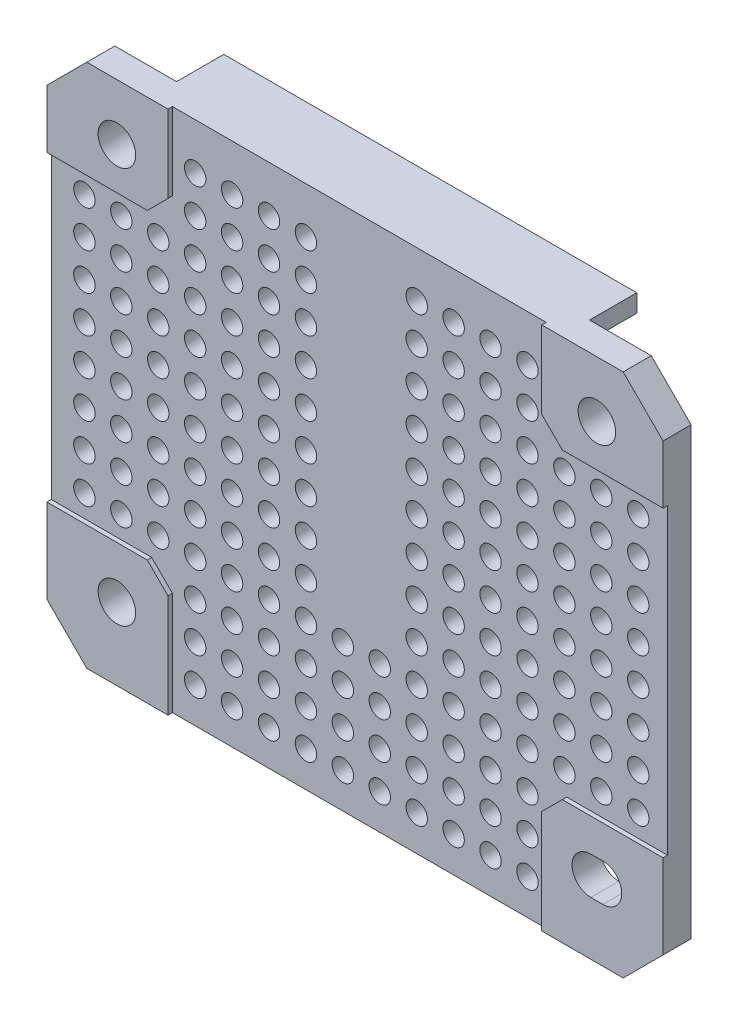
from build123d import *

# Parameters (mm, degrees)
BOSS_EXTRUDE1_DEPTH = 2.032
BOSS_EXTRUDE2_DEPTH = 0.381
SKETCH3_W           = 35.5092
SKETCH3_H           = 1.524
BOSS_EXTRUDE3_DEPTH = 4.064
SKETCH4_R           = 1.6129
SKETCH4_R_2         = 0.92075
CUT_EXTRUDE1_DEPTH  = 70.721612008


with BuildPart() as part:
    # Sketch1 → Boss-Extrude1 (new body)
    with BuildSketch(Plane.XY):
        Polygon((0, 41.7068), (3.429, 45.1358), (49.5554, 45.1358), (52.9844, 41.7068), (52.9844, 3.429), (49.5554, 0), (3.429, 0), (0, 3.429), align=None)
    extrude(amount=BOSS_EXTRUDE1_DEPTH)

    # Sketch2 → Boss-Extrude2 (add)
    with BuildSketch(Plane.XY.offset(2.032)):
        Polygon((3.429, 45.1358), (0, 41.7068), (0, 36.703), (8.636, 36.703), (10.414, 38.481), (10.414, 45.1358), align=None)
        Polygon((42.545, 45.1358), (42.545, 38.481), (44.323, 36.703), (52.9844, 36.703), (52.9844, 41.7068), (49.5554, 45.1358), align=None)
        Polygon((0, 10.668), (8.636, 10.668), (10.414, 8.89), (10.414, 0), (3.429, 0), (0, 3.429), align=None)
        Polygon((52.9844, 10.668), (44.323, 10.668), (42.545, 8.89), (42.545, 0), (49.5554, 0), (52.9844, 3.429), align=None)
    extrude(amount=BOSS_EXTRUDE2_DEPTH)

    # Sketch3 → Boss-Extrude3 (add)
    with BuildSketch(Plane(origin=(0, 0, 0), x_dir=(-1, 0, 0), z_dir=(0, 0, -1))):
        with Locations((-26.4922, 44.3738)):
            Rectangle(SKETCH3_W, SKETCH3_H)
    extrude(amount=BOSS_EXTRUDE3_DEPTH)

    # Sketch4 → Cut-Extrude1 (cut, through all)
    with BuildSketch(Plane(origin=(0, 0, 0), x_dir=(-1, 0, 0), z_dir=(0, 0, -1))):
        with Locations((-47.2948, 40.3098)):
            Circle(SKETCH4_R)
        with Locations((-6.0198, 40.3098)):
            Circle(SKETCH4_R)
        with Locations((-6.0198, 6.223)):
            Circle(SKETCH4_R)
        with Locations((-2.8448, 12.573)):
            Circle(SKETCH4_R_2)
        with Locations((-6.0198, 12.573)):
            Circle(SKETCH4_R_2)
        with Locations((-9.1948, 12.573)):
            Circle(SKETCH4_R_2)
        with Locations((-40.9448, 12.573)):
            Circle(SKETCH4_R_2)
        with Locations((-44.1198, 12.573)):
            Circle(SKETCH4_R_2)
        with Locations((-47.2948, 12.573)):
            Circle(SKETCH4_R_2)
        with Locations((-50.4698, 12.573)):
            Circle(SKETCH4_R_2)
        with Locations((-6.0198, 15.748)):
            Circle(SKETCH4_R_2)
        with Locations((-9.1948, 15.748)):
            Circle(SKETCH4_R_2)
        with Locations((-12.3698, 15.748)):
            Circle(SKETCH4_R_2)
        with Locations((-15.5448, 15.748)):
            Circle(SKETCH4_R_2)
        with Locations((-18.7198, 15.748)):
            Circle(SKETCH4_R_2)
        with Locations((-21.8948, 15.748)):
            Circle(SKETCH4_R_2)
        with Locations((-31.4198, 15.748)):
            Circle(SKETCH4_R_2)
        with Locations((-34.5948, 15.748)):
            Circle(SKETCH4_R_2)
        with Locations((-37.7698, 15.748)):
            Circle(SKETCH4_R_2)
        with Locations((-40.9448, 15.748)):
            Circle(SKETCH4_R_2)
        with Locations((-44.1198, 15.748)):
            Circle(SKETCH4_R_2)
        with Locations((-47.2948, 15.748)):
            Circle(SKETCH4_R_2)
        with Locations((-50.4698, 15.748)):
            Circle(SKETCH4_R_2)
        with Locations((-6.0198, 18.923)):
            Circle(SKETCH4_R_2)
        with Locations((-9.1948, 18.923)):
            Circle(SKETCH4_R_2)
        with Locations((-12.3698, 18.923)):
            Circle(SKETCH4_R_2)
        with Locations((-15.5448, 18.923)):
            Circle(SKETCH4_R_2)
        with Locations((-18.7198, 18.923)):
            Circle(SKETCH4_R_2)
        with Locations((-21.8948, 18.923)):
            Circle(SKETCH4_R_2)
        with Locations((-31.4198, 18.923)):
            Circle(SKETCH4_R_2)
        with Locations((-34.5948, 18.923)):
            Circle(SKETCH4_R_2)
        with Locations((-37.7698, 18.923)):
            Circle(SKETCH4_R_2)
        with Locations((-40.9448, 18.923)):
            Circle(SKETCH4_R_2)
        with Locations((-44.1198, 18.923)):
            Circle(SKETCH4_R_2)
        with Locations((-47.2948, 18.923)):
            Circle(SKETCH4_R_2)
        with Locations((-50.4698, 18.923)):
            Circle(SKETCH4_R_2)
        with Locations((-6.0198, 22.098)):
            Circle(SKETCH4_R_2)
        with Locations((-9.1948, 22.098)):
            Circle(SKETCH4_R_2)
        with Locations((-12.3698, 22.098)):
            Circle(SKETCH4_R_2)
        with Locations((-15.5448, 22.098)):
            Circle(SKETCH4_R_2)
        with Locations((-18.7198, 22.098)):
            Circle(SKETCH4_R_2)
        with Locations((-21.8948, 22.098)):
            Circle(SKETCH4_R_2)
        with Locations((-31.4198, 22.098)):
            Circle(SKETCH4_R_2)
        with Locations((-34.5948, 22.098)):
            Circle(SKETCH4_R_2)
        with Locations((-37.7698, 22.098)):
            Circle(SKETCH4_R_2)
        with Locations((-40.9448, 22.098)):
            Circle(SKETCH4_R_2)
        with Locations((-44.1198, 22.098)):
            Circle(SKETCH4_R_2)
        with Locations((-47.2948, 22.098)):
            Circle(SKETCH4_R_2)
        with Locations((-50.4698, 22.098)):
            Circle(SKETCH4_R_2)
        with Locations((-6.0198, 25.273)):
            Circle(SKETCH4_R_2)
        with Locations((-9.1948, 25.273)):
            Circle(SKETCH4_R_2)
        with Locations((-12.3698, 25.273)):
            Circle(SKETCH4_R_2)
        with Locations((-15.5448, 25.273)):
            Circle(SKETCH4_R_2)
        with Locations((-18.7198, 25.273)):
            Circle(SKETCH4_R_2)
        with Locations((-21.8948, 25.273)):
            Circle(SKETCH4_R_2)
        with Locations((-31.4198, 25.273)):
            Circle(SKETCH4_R_2)
        with Locations((-34.5948, 25.273)):
            Circle(SKETCH4_R_2)
        with Locations((-37.7698, 25.273)):
            Circle(SKETCH4_R_2)
        with Locations((-40.9448, 25.273)):
            Circle(SKETCH4_R_2)
        with Locations((-44.1198, 25.273)):
            Circle(SKETCH4_R_2)
        with Locations((-47.2948, 25.273)):
            Circle(SKETCH4_R_2)
        with Locations((-50.4698, 25.273)):
            Circle(SKETCH4_R_2)
        with Locations((-6.0198, 28.448)):
            Circle(SKETCH4_R_2)
        with Locations((-9.1948, 28.448)):
            Circle(SKETCH4_R_2)
        with Locations((-12.3698, 28.448)):
            Circle(SKETCH4_R_2)
        with Locations((-15.5448, 28.448)):
            Circle(SKETCH4_R_2)
        with Locations((-18.7198, 28.448)):
            Circle(SKETCH4_R_2)
        with Locations((-21.8948, 28.448)):
            Circle(SKETCH4_R_2)
        with Locations((-31.4198, 28.448)):
            Circle(SKETCH4_R_2)
        with Locations((-34.5948, 28.448)):
            Circle(SKETCH4_R_2)
        with Locations((-37.7698, 28.448)):
            Circle(SKETCH4_R_2)
        with Locations((-40.9448, 28.448)):
            Circle(SKETCH4_R_2)
        with Locations((-44.1198, 28.448)):
            Circle(SKETCH4_R_2)
        with Locations((-47.2948, 28.448)):
            Circle(SKETCH4_R_2)
        with Locations((-50.4698, 28.448)):
            Circle(SKETCH4_R_2)
        with Locations((-6.0198, 31.623)):
            Circle(SKETCH4_R_2)
        with Locations((-9.1948, 31.623)):
            Circle(SKETCH4_R_2)
        with Locations((-12.3698, 31.623)):
            Circle(SKETCH4_R_2)
        with Locations((-15.5448, 31.623)):
            Circle(SKETCH4_R_2)
        with Locations((-18.7198, 31.623)):
            Circle(SKETCH4_R_2)
        with Locations((-21.8948, 31.623)):
            Circle(SKETCH4_R_2)
        with Locations((-31.4198, 31.623)):
            Circle(SKETCH4_R_2)
        with Locations((-34.5948, 31.623)):
            Circle(SKETCH4_R_2)
        with Locations((-37.7698, 31.623)):
            Circle(SKETCH4_R_2)
        with Locations((-40.9448, 31.623)):
            Circle(SKETCH4_R_2)
        with Locations((-44.1198, 31.623)):
            Circle(SKETCH4_R_2)
        with Locations((-47.2948, 31.623)):
            Circle(SKETCH4_R_2)
        with Locations((-50.4698, 31.623)):
            Circle(SKETCH4_R_2)
        with Locations((-6.0198, 34.798)):
            Circle(SKETCH4_R_2)
        with Locations((-9.1948, 34.798)):
            Circle(SKETCH4_R_2)
        with Locations((-12.3698, 34.798)):
            Circle(SKETCH4_R_2)
        with Locations((-15.5448, 34.798)):
            Circle(SKETCH4_R_2)
        with Locations((-18.7198, 34.798)):
            Circle(SKETCH4_R_2)
        with Locations((-21.8948, 34.798)):
            Circle(SKETCH4_R_2)
        with Locations((-31.4198, 34.798)):
            Circle(SKETCH4_R_2)
        with Locations((-34.5948, 34.798)):
            Circle(SKETCH4_R_2)
        with Locations((-37.7698, 34.798)):
            Circle(SKETCH4_R_2)
        with Locations((-40.9448, 34.798)):
            Circle(SKETCH4_R_2)
        with Locations((-44.1198, 34.798)):
            Circle(SKETCH4_R_2)
        with Locations((-47.2948, 34.798)):
            Circle(SKETCH4_R_2)
        with Locations((-50.4698, 34.798)):
            Circle(SKETCH4_R_2)
        with Locations((-12.3698, 37.973)):
            Circle(SKETCH4_R_2)
        with Locations((-15.5448, 37.973)):
            Circle(SKETCH4_R_2)
        with Locations((-18.7198, 37.973)):
            Circle(SKETCH4_R_2)
        with Locations((-21.8948, 37.973)):
            Circle(SKETCH4_R_2)
        with Locations((-31.4198, 37.973)):
            Circle(SKETCH4_R_2)
        with Locations((-34.5948, 37.973)):
            Circle(SKETCH4_R_2)
        with Locations((-37.7698, 37.973)):
            Circle(SKETCH4_R_2)
        with Locations((-40.9448, 37.973)):
            Circle(SKETCH4_R_2)
        with Locations((-12.3698, 41.148)):
            Circle(SKETCH4_R_2)
        with Locations((-15.5448, 41.148)):
            Circle(SKETCH4_R_2)
        with Locations((-18.7198, 41.148)):
            Circle(SKETCH4_R_2)
        with Locations((-21.8948, 41.148)):
            Circle(SKETCH4_R_2)
        with Locations((-31.4198, 41.148)):
            Circle(SKETCH4_R_2)
        with Locations((-34.5948, 41.148)):
            Circle(SKETCH4_R_2)
        with Locations((-37.7698, 41.148)):
            Circle(SKETCH4_R_2)
        with Locations((-40.9448, 41.148)):
            Circle(SKETCH4_R_2)
        with Locations((-2.8448, 15.748)):
            Circle(SKETCH4_R_2)
        with Locations((-2.8448, 18.923)):
            Circle(SKETCH4_R_2)
        with Locations((-2.8448, 22.098)):
            Circle(SKETCH4_R_2)
        with Locations((-2.8448, 25.273)):
            Circle(SKETCH4_R_2)
        with Locations((-2.8448, 28.448)):
            Circle(SKETCH4_R_2)
        with Locations((-2.8448, 31.623)):
            Circle(SKETCH4_R_2)
        with Locations((-2.8448, 34.798)):
            Circle(SKETCH4_R_2)
        with Locations((-37.7698, 12.573)):
            Circle(SKETCH4_R_2)
        with Locations((-34.5948, 12.573)):
            Circle(SKETCH4_R_2)
        with Locations((-31.4198, 12.573)):
            Circle(SKETCH4_R_2)
        with Locations((-28.2448, 12.573)):
            Circle(SKETCH4_R_2)
        with Locations((-25.0698, 12.573)):
            Circle(SKETCH4_R_2)
        with Locations((-21.8948, 12.573)):
            Circle(SKETCH4_R_2)
        with Locations((-18.7198, 12.573)):
            Circle(SKETCH4_R_2)
        with Locations((-15.5448, 12.573)):
            Circle(SKETCH4_R_2)
        with Locations((-12.3698, 12.573)):
            Circle(SKETCH4_R_2)
        with Locations((-37.7698, 9.398)):
            Circle(SKETCH4_R_2)
        with Locations((-34.5948, 9.398)):
            Circle(SKETCH4_R_2)
        with Locations((-31.4198, 9.398)):
            Circle(SKETCH4_R_2)
        with Locations((-28.2448, 9.398)):
            Circle(SKETCH4_R_2)
        with Locations((-25.0698, 9.398)):
            Circle(SKETCH4_R_2)
        with Locations((-21.8948, 9.398)):
            Circle(SKETCH4_R_2)
        with Locations((-18.7198, 9.398)):
            Circle(SKETCH4_R_2)
        with Locations((-15.5448, 9.398)):
            Circle(SKETCH4_R_2)
        with Locations((-12.3698, 9.398)):
            Circle(SKETCH4_R_2)
        with Locations((-37.7698, 6.223)):
            Circle(SKETCH4_R_2)
        with Locations((-34.5948, 6.223)):
            Circle(SKETCH4_R_2)
        with Locations((-31.4198, 6.223)):
            Circle(SKETCH4_R_2)
        with Locations((-28.2448, 6.223)):
            Circle(SKETCH4_R_2)
        with Locations((-25.0698, 6.223)):
            Circle(SKETCH4_R_2)
        with Locations((-21.8948, 6.223)):
            Circle(SKETCH4_R_2)
        with Locations((-18.7198, 6.223)):
            Circle(SKETCH4_R_2)
        with Locations((-15.5448, 6.223)):
            Circle(SKETCH4_R_2)
        with Locations((-12.3698, 6.223)):
            Circle(SKETCH4_R_2)
        with Locations((-37.7698, 3.048)):
            Circle(SKETCH4_R_2)
        with Locations((-34.5948, 3.048)):
            Circle(SKETCH4_R_2)
        with Locations((-31.4198, 3.048)):
            Circle(SKETCH4_R_2)
        with Locations((-28.2448, 3.048)):
            Circle(SKETCH4_R_2)
        with Locations((-25.0698, 3.048)):
            Circle(SKETCH4_R_2)
        with Locations((-21.8948, 3.048)):
            Circle(SKETCH4_R_2)
        with Locations((-18.7198, 3.048)):
            Circle(SKETCH4_R_2)
        with Locations((-15.5448, 3.048)):
            Circle(SKETCH4_R_2)
        with Locations((-12.3698, 3.048)):
            Circle(SKETCH4_R_2)
        with Locations((-40.9448, 9.398)):
            Circle(SKETCH4_R_2)
        with Locations((-40.9448, 6.223)):
            Circle(SKETCH4_R_2)
        with Locations((-40.9448, 3.048)):
            Circle(SKETCH4_R_2)
        with BuildLine():
            Line((-47.8155, 7.8359), (-46.7741, 7.8359))
            ThreePointArc((-46.7741, 7.8359), (-45.1612, 6.223), (-46.7741, 4.6101))
            Line((-46.7741, 4.6101), (-47.8155, 4.6101))
            ThreePointArc((-47.8155, 4.6101), (-49.4284, 6.223), (-47.8155, 7.8359))
        make_face()
    extrude(amount=-CUT_EXTRUDE1_DEPTH, mode=Mode.SUBTRACT)


solid = part.part
